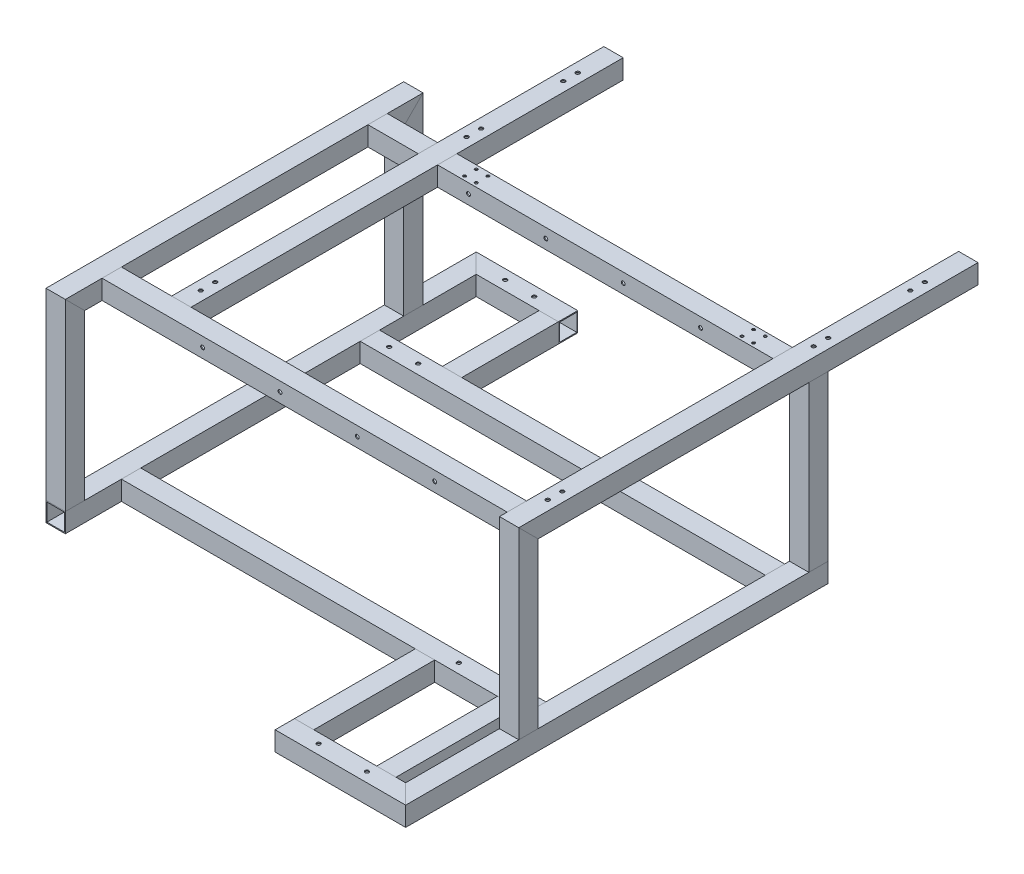
from build123d import *

# Parameters (mm, degrees)
F_SOLIDWORKS2016_SOLIDWORKS_LANG_CHINESE_DEPTH      = 454.142135624
F_SOLIDWORKS2016_SOLIDWORKS_LANG_CHINESE_DEPTH_BACK = 15.142135624
SKETCH_12_W                                         = 20
SKETCH_12_H                                         = 20
SKETCH_12_W_2                                       = 18
SKETCH_12_H_2                                       = 18
SKETCH_12_ON_SEGMENT_2_W                            = 20
SKETCH_12_ON_SEGMENT_2_H                            = 20
SKETCH_12_ON_SEGMENT_2_W_2                          = 18
SKETCH_12_ON_SEGMENT_2_H_2                          = 18
F_SOLIDWORKS2016_SOLIDWORKS_LANG_CHI_4_DEPTH        = 542.284271247
SKETCH_12_ON_SEGMENT_3_W                            = 20
SKETCH_12_ON_SEGMENT_3_H                            = 20
SKETCH_12_ON_SEGMENT_3_W_2                          = 18
SKETCH_12_ON_SEGMENT_3_H_2                          = 18
F_SOLIDWORKS2016_SOLIDWORKS_LANG_CHI_6_DEPTH        = 469.284271247
SKETCH_12_ON_SEGMENT_4_W                            = 20
SKETCH_12_ON_SEGMENT_4_H                            = 20
SKETCH_12_ON_SEGMENT_4_W_2                          = 18
SKETCH_12_ON_SEGMENT_4_H_2                          = 18
F_SOLIDWORKS2016_SOLIDWORKS_LANG_CHI_8_DEPTH        = 542.284271247
SKETCH_12_ON_SEGMENT_5_W                            = 20
SKETCH_12_ON_SEGMENT_5_H                            = 20
SKETCH_12_ON_SEGMENT_5_W_2                          = 18
SKETCH_12_ON_SEGMENT_5_H_2                          = 18
F_SOLIDWORKS2016_SOLIDWORKS_LANG_CHI_10_DEPTH       = 441
SKETCH_12_ON_SEGMENT_6_W                            = 20
SKETCH_12_ON_SEGMENT_6_H                            = 20
SKETCH_12_ON_SEGMENT_6_W_2                          = 18
SKETCH_12_ON_SEGMENT_6_H_2                          = 18
F_SOLIDWORKS2016_SOLIDWORKS_LANG_CHI_13_DEPTH       = 441
SKETCH_12_ON_SEGMENT_7_W                            = 20
SKETCH_12_ON_SEGMENT_7_H                            = 20
SKETCH_12_ON_SEGMENT_7_W_2                          = 18
SKETCH_12_ON_SEGMENT_7_H_2                          = 18
F_SOLIDWORKS2016_SOLIDWORKS_LANG_CHI_16_DEPTH       = 206.142135624
SKETCH_12_ON_SEGMENT_8_W                            = 20
SKETCH_12_ON_SEGMENT_8_H                            = 20
SKETCH_12_ON_SEGMENT_8_W_2                          = 18
SKETCH_12_ON_SEGMENT_8_H_2                          = 18
F_SOLIDWORKS2016_SOLIDWORKS_LANG_CHI_19_DEPTH       = 380.284271247
SKETCH_12_ON_SEGMENT_9_W                            = 20
SKETCH_12_ON_SEGMENT_9_H                            = 20
SKETCH_12_ON_SEGMENT_9_W_2                          = 18
SKETCH_12_ON_SEGMENT_9_H_2                          = 18
F_SOLIDWORKS2016_SOLIDWORKS_LANG_CHI_22_DEPTH       = 206.142135624
SKETCH_12_ON_SEGMENT_10_W                           = 20
SKETCH_12_ON_SEGMENT_10_H                           = 20
SKETCH_12_ON_SEGMENT_10_W_2                         = 18
SKETCH_12_ON_SEGMENT_10_H_2                         = 18
F_SOLIDWORKS2016_SOLIDWORKS_LANG_CHI_25_DEPTH       = 206.142135624
SKETCH_12_ON_SEGMENT_11_W                           = 20
SKETCH_12_ON_SEGMENT_11_H                           = 20
SKETCH_12_ON_SEGMENT_11_W_2                         = 18
SKETCH_12_ON_SEGMENT_11_H_2                         = 18
F_SOLIDWORKS2016_SOLIDWORKS_LANG_CHI_28_DEPTH       = 480.142135624
SKETCH_12_ON_SEGMENT_12_W                           = 20
SKETCH_12_ON_SEGMENT_12_H                           = 20
SKETCH_12_ON_SEGMENT_12_W_2                         = 18
SKETCH_12_ON_SEGMENT_12_H_2                         = 18
F_SOLIDWORKS2016_SOLIDWORKS_LANG_CHI_30_DEPTH       = 192
SKETCH_12_ON_SEGMENT_13_W                           = 20
SKETCH_12_ON_SEGMENT_13_H                           = 20
SKETCH_12_ON_SEGMENT_13_W_2                         = 18
SKETCH_12_ON_SEGMENT_13_H_2                         = 18
F_SOLIDWORKS2016_SOLIDWORKS_LANG_CHI_33_DEPTH       = 441
SKETCH_12_ON_SEGMENT_14_W                           = 20
SKETCH_12_ON_SEGMENT_14_H                           = 20
SKETCH_12_ON_SEGMENT_14_W_2                         = 18
SKETCH_12_ON_SEGMENT_14_H_2                         = 18
F_SOLIDWORKS2016_SOLIDWORKS_LANG_CHI_36_DEPTH       = 458
SKETCH_12_ON_SEGMENT_15_W                           = 20
SKETCH_12_ON_SEGMENT_15_H                           = 20
SKETCH_12_ON_SEGMENT_15_W_2                         = 18
SKETCH_12_ON_SEGMENT_15_H_2                         = 18
F_SOLIDWORKS2016_SOLIDWORKS_LANG_CHI_38_DEPTH       = 369
SKETCH_12_ON_SEGMENT_16_W                           = 20
SKETCH_12_ON_SEGMENT_16_H                           = 20
SKETCH_12_ON_SEGMENT_16_W_2                         = 18
SKETCH_12_ON_SEGMENT_16_H_2                         = 18
F_SOLIDWORKS2016_SOLIDWORKS_LANG_CHI_41_DEPTH       = 74
SKETCH_12_ON_SEGMENT_17_W                           = 20
SKETCH_12_ON_SEGMENT_17_H                           = 20
SKETCH_12_ON_SEGMENT_17_W_2                         = 18
SKETCH_12_ON_SEGMENT_17_H_2                         = 18
F_SOLIDWORKS2016_SOLIDWORKS_LANG_CHI_44_DEPTH       = 147
SKETCH_12_ON_SEGMENT_18_W                           = 20
SKETCH_12_ON_SEGMENT_18_H                           = 20
SKETCH_12_ON_SEGMENT_18_W_2                         = 18
SKETCH_12_ON_SEGMENT_18_H_2                         = 18
F_SOLIDWORKS2016_SOLIDWORKS_LANG_CHI_47_DEPTH       = 147
SKETCH_13_R                                         = 2
CUT_EXTRUDE_1_DEPTH                                 = 674.740306053
SKETCH_14_R                                         = 2
CUT_EXTRUDE_2_DEPTH                                 = 674.740306053
CUT_EXTRUDE_4_REACH                                 = 681.651
SKETCH_16_R                                         = 2
SKETCH_23_W                                         = 354
SKETCH_23_H                                         = 95
CUT_EXTRUDE_10_DEPTH                                = 674.740306053
SKETCH_24_W                                         = 20
SKETCH_24_H                                         = 100
EXTRUDE_2_DEPTH                                     = 20
SKETCH_25_R                                         = 2
CUT_EXTRUDE_11_DEPTH                                = 20
SKETCH_27_R                                         = 2
CUT_EXTRUDE_12_DEPTH                                = 679.004424764
CUT_EXTRUDE_13_DEPTH                                = 20
SKETCH_29_R                                         = 1.5
CUT_EXTRUDE_14_DEPTH                                = 20


with BuildPart() as part:
    # 草图12 → F_SOLIDWORKS2016_SOLIDWORKS_LANG_CHINESE (new, two sides: drawn at the far end of the back side and taken through both)
    with BuildSketch(Plane(origin=(0, 0, 117), x_dir=(0, 0, 1), z_dir=(-1, 0, 0)).offset(-F_SOLIDWORKS2016_SOLIDWORKS_LANG_CHINESE_DEPTH_BACK)):
        Rectangle(SKETCH_12_W, SKETCH_12_H)
        Rectangle(SKETCH_12_W_2, SKETCH_12_H_2, mode=Mode.SUBTRACT)
    extrude(amount=F_SOLIDWORKS2016_SOLIDWORKS_LANG_CHINESE_DEPTH + F_SOLIDWORKS2016_SOLIDWORKS_LANG_CHINESE_DEPTH_BACK)

    # F_SOLIDWORKS2016_SOLIDWORKS_LANG_CHI 2
    split(bisect_by=Plane(origin=(0, 0, 117), x_dir=(0, -1, 0), z_dir=(-0.707106781, 0, 0.707106781)), keep=Keep.TOP)

    # F_SOLIDWORKS2016_SOLIDWORKS_LANG_CHI 3
    split(bisect_by=Plane(origin=(-439, 0, 117), x_dir=(0, 1, 0), z_dir=(0.707106781, 0, 0.707106781)), keep=Keep.TOP)


with BuildPart() as body_2:
    # 草图12 on segment 2 (carried to segment 2) → F_SOLIDWORKS2016_SOLIDWORKS_LANG_CHI 4 (new body)
    with BuildSketch(Plane(origin=(-439, 0, 132.142135624), x_dir=(-1, 0, 0), z_dir=(0, 0, -1))):
        Rectangle(SKETCH_12_ON_SEGMENT_2_W, SKETCH_12_ON_SEGMENT_2_H)
        Rectangle(SKETCH_12_ON_SEGMENT_2_W_2, SKETCH_12_ON_SEGMENT_2_H_2, mode=Mode.SUBTRACT)
    extrude(amount=F_SOLIDWORKS2016_SOLIDWORKS_LANG_CHI_4_DEPTH)

    # F_SOLIDWORKS2016_SOLIDWORKS_LANG_CHI 4 m
    split(bisect_by=Plane(origin=(-439, 0, 117), x_dir=(0, -1, 0), z_dir=(-0.707106781, 0, -0.707106781)), keep=Keep.TOP)

    # F_SOLIDWORKS2016_SOLIDWORKS_LANG_CHI 5
    split(bisect_by=Plane(origin=(-439, 0, -395), x_dir=(0, -1, 0), z_dir=(-0.707106781, 0, 0.707106781)), keep=Keep.TOP)


with BuildPart() as body_3:
    # 草图12 on segment 3 (carried to segment 3) → F_SOLIDWORKS2016_SOLIDWORKS_LANG_CHI 6 (new body)
    with BuildSketch(Plane(origin=(-454.142135624, 0, -395), x_dir=(0, 0, -1), z_dir=(1, 0, 0))):
        Rectangle(SKETCH_12_ON_SEGMENT_3_W, SKETCH_12_ON_SEGMENT_3_H)
        Rectangle(SKETCH_12_ON_SEGMENT_3_W_2, SKETCH_12_ON_SEGMENT_3_H_2, mode=Mode.SUBTRACT)
    extrude(amount=F_SOLIDWORKS2016_SOLIDWORKS_LANG_CHI_6_DEPTH)

    # F_SOLIDWORKS2016_SOLIDWORKS_LANG_CHI 6 m
    split(bisect_by=Plane(origin=(-439, 0, -395), x_dir=(0, 1, 0), z_dir=(0.707106781, 0, -0.707106781)), keep=Keep.TOP)

    # F_SOLIDWORKS2016_SOLIDWORKS_LANG_CHI 7
    split(bisect_by=Plane(origin=(0, 0, -395), x_dir=(0, -1, 0), z_dir=(-0.707106781, 0, -0.707106781)), keep=Keep.TOP)


with BuildPart() as body_4:
    # 草图12 on segment 4 (carried to segment 4) → F_SOLIDWORKS2016_SOLIDWORKS_LANG_CHI 8 (new body)
    with BuildSketch(Plane.XY.offset(-410.142135624)):
        Rectangle(SKETCH_12_ON_SEGMENT_4_W, SKETCH_12_ON_SEGMENT_4_H)
        Rectangle(SKETCH_12_ON_SEGMENT_4_W_2, SKETCH_12_ON_SEGMENT_4_H_2, mode=Mode.SUBTRACT)
    extrude(amount=F_SOLIDWORKS2016_SOLIDWORKS_LANG_CHI_8_DEPTH)

    # F_SOLIDWORKS2016_SOLIDWORKS_LANG_CHI 8 m
    split(bisect_by=Plane(origin=(0, 0, -395), x_dir=(0, 1, 0), z_dir=(0.707106781, 0, 0.707106781)), keep=Keep.TOP)

    # F_SOLIDWORKS2016_SOLIDWORKS_LANG_CHI 9
    split(bisect_by=Plane(origin=(0, 0, 117), x_dir=(0, 1, 0), z_dir=(0.707106781, 0, -0.707106781)), keep=Keep.TOP)


with BuildPart() as body_5:
    # 草图12 on segment 5 (carried to segment 5) → F_SOLIDWORKS2016_SOLIDWORKS_LANG_CHI 10 (new body)
    with BuildSketch(Plane(origin=(-440, 0, -28), x_dir=(0, 0, -1), z_dir=(1, 0, 0))):
        Rectangle(SKETCH_12_ON_SEGMENT_5_W, SKETCH_12_ON_SEGMENT_5_H)
        Rectangle(SKETCH_12_ON_SEGMENT_5_W_2, SKETCH_12_ON_SEGMENT_5_H_2, mode=Mode.SUBTRACT)
    extrude(amount=F_SOLIDWORKS2016_SOLIDWORKS_LANG_CHI_10_DEPTH)

    # F_SOLIDWORKS2016_SOLIDWORKS_LANG_CHI 11
    split(bisect_by=Plane(origin=(-429, 0, -28), x_dir=(0, 1, 0), z_dir=(1, 0, 0)), keep=Keep.TOP)

    # F_SOLIDWORKS2016_SOLIDWORKS_LANG_CHI 12
    split(bisect_by=Plane(origin=(-10, 0, -28), x_dir=(0, -1, 0), z_dir=(-1, 0, 0)), keep=Keep.TOP)


with BuildPart() as body_6:
    # 草图12 on segment 6 (carried to segment 6) → F_SOLIDWORKS2016_SOLIDWORKS_LANG_CHI 13 (new body)
    with BuildSketch(Plane(origin=(-440, 0, -275), x_dir=(0, 0, -1), z_dir=(1, 0, 0))):
        Rectangle(SKETCH_12_ON_SEGMENT_6_W, SKETCH_12_ON_SEGMENT_6_H)
        Rectangle(SKETCH_12_ON_SEGMENT_6_W_2, SKETCH_12_ON_SEGMENT_6_H_2, mode=Mode.SUBTRACT)
    extrude(amount=F_SOLIDWORKS2016_SOLIDWORKS_LANG_CHI_13_DEPTH)

    # F_SOLIDWORKS2016_SOLIDWORKS_LANG_CHI 14
    split(bisect_by=Plane(origin=(-429, 0, -275), x_dir=(0, 1, 0), z_dir=(1, 0, 0)), keep=Keep.TOP)

    # F_SOLIDWORKS2016_SOLIDWORKS_LANG_CHI 15
    split(bisect_by=Plane(origin=(-10, 0, -275), x_dir=(0, -1, 0), z_dir=(-1, 0, 0)), keep=Keep.TOP)


with BuildPart() as body_7:
    # 草图12 on segment 7 (carried to segment 7) → F_SOLIDWORKS2016_SOLIDWORKS_LANG_CHI 16 (new body)
    with BuildSketch(Plane(origin=(-439, 205.142135624, -320), x_dir=(0, 0, 1), z_dir=(0, -1, 0))):
        Rectangle(SKETCH_12_ON_SEGMENT_7_W, SKETCH_12_ON_SEGMENT_7_H)
        Rectangle(SKETCH_12_ON_SEGMENT_7_W_2, SKETCH_12_ON_SEGMENT_7_H_2, mode=Mode.SUBTRACT)
    extrude(amount=F_SOLIDWORKS2016_SOLIDWORKS_LANG_CHI_16_DEPTH)

    # F_SOLIDWORKS2016_SOLIDWORKS_LANG_CHI 17
    split(bisect_by=Plane(origin=(-439, 190, -320), x_dir=(1, 0, 0), z_dir=(0, -0.707106781, -0.707106781)), keep=Keep.TOP)

    # F_SOLIDWORKS2016_SOLIDWORKS_LANG_CHI 18
    split(bisect_by=Plane(origin=(-439, 10, -320), x_dir=(-1, 0, 0), z_dir=(0, 1, 0)), keep=Keep.TOP)


with BuildPart() as body_8:
    # 草图12 on segment 8 (carried to segment 8) → F_SOLIDWORKS2016_SOLIDWORKS_LANG_CHI 19 (new body)
    with BuildSketch(Plane(origin=(-439, 190, 45.142135624), x_dir=(-1, 0, 0), z_dir=(0, 0, -1))):
        Rectangle(SKETCH_12_ON_SEGMENT_8_W, SKETCH_12_ON_SEGMENT_8_H)
        Rectangle(SKETCH_12_ON_SEGMENT_8_W_2, SKETCH_12_ON_SEGMENT_8_H_2, mode=Mode.SUBTRACT)
    extrude(amount=F_SOLIDWORKS2016_SOLIDWORKS_LANG_CHI_19_DEPTH)

    # F_SOLIDWORKS2016_SOLIDWORKS_LANG_CHI 20
    split(bisect_by=Plane(origin=(-439, 190, 30), x_dir=(-1, 0, 0), z_dir=(0, 0.707106781, -0.707106781)), keep=Keep.TOP)

    # F_SOLIDWORKS2016_SOLIDWORKS_LANG_CHI 21
    split(bisect_by=Plane(origin=(-439, 190, -320), x_dir=(-1, 0, 0), z_dir=(0, 0.707106781, 0.707106781)), keep=Keep.TOP)


with BuildPart() as body_9:
    # 草图12 on segment 9 (carried to segment 9) → F_SOLIDWORKS2016_SOLIDWORKS_LANG_CHI 22 (new body)
    with BuildSketch(Plane(origin=(-439, 205.142135624, 30), x_dir=(0, 0, 1), z_dir=(0, -1, 0))):
        Rectangle(SKETCH_12_ON_SEGMENT_9_W, SKETCH_12_ON_SEGMENT_9_H)
        Rectangle(SKETCH_12_ON_SEGMENT_9_W_2, SKETCH_12_ON_SEGMENT_9_H_2, mode=Mode.SUBTRACT)
    extrude(amount=F_SOLIDWORKS2016_SOLIDWORKS_LANG_CHI_22_DEPTH)

    # F_SOLIDWORKS2016_SOLIDWORKS_LANG_CHI 23
    split(bisect_by=Plane(origin=(-439, 190, 30), x_dir=(1, 0, 0), z_dir=(0, -0.707106781, 0.707106781)), keep=Keep.TOP)

    # F_SOLIDWORKS2016_SOLIDWORKS_LANG_CHI 24
    split(bisect_by=Plane(origin=(-439, 10, 30), x_dir=(-1, 0, 0), z_dir=(0, 1, 0)), keep=Keep.TOP)


with BuildPart() as body_10:
    # 草图12 on segment 10 (carried to segment 10) → F_SOLIDWORKS2016_SOLIDWORKS_LANG_CHI 25 (new body)
    with BuildSketch(Plane.ZX.offset(-1)):
        Rectangle(SKETCH_12_ON_SEGMENT_10_W, SKETCH_12_ON_SEGMENT_10_H)
        Rectangle(SKETCH_12_ON_SEGMENT_10_W_2, SKETCH_12_ON_SEGMENT_10_H_2, mode=Mode.SUBTRACT)
    extrude(amount=F_SOLIDWORKS2016_SOLIDWORKS_LANG_CHI_25_DEPTH)

    # F_SOLIDWORKS2016_SOLIDWORKS_LANG_CHI 26
    split(bisect_by=Plane(origin=(0, 190, 0), x_dir=(1, 0, 0), z_dir=(0, -0.707106781, 0.707106781)), keep=Keep.TOP)

    # F_SOLIDWORKS2016_SOLIDWORKS_LANG_CHI 27
    split(bisect_by=Plane(origin=(0, 10, 0), x_dir=(-1, 0, 0), z_dir=(0, 1, 0)), keep=Keep.TOP)


with BuildPart() as body_11:
    # 草图12 on segment 11 (carried to segment 11) → F_SOLIDWORKS2016_SOLIDWORKS_LANG_CHI 28 (new body)
    with BuildSketch(Plane(origin=(0, 190, 15.142135624), x_dir=(-1, 0, 0), z_dir=(0, 0, -1))):
        Rectangle(SKETCH_12_ON_SEGMENT_11_W, SKETCH_12_ON_SEGMENT_11_H)
        Rectangle(SKETCH_12_ON_SEGMENT_11_W_2, SKETCH_12_ON_SEGMENT_11_H_2, mode=Mode.SUBTRACT)
    extrude(amount=F_SOLIDWORKS2016_SOLIDWORKS_LANG_CHI_28_DEPTH)

    # F_SOLIDWORKS2016_SOLIDWORKS_LANG_CHI 29
    split(bisect_by=Plane(origin=(0, 190, 0), x_dir=(-1, 0, 0), z_dir=(0, 0.707106781, -0.707106781)), keep=Keep.TOP)

    # 切除-拉伸4: up to this face of the body (flat: up to its plane)
    cut_extrude_4_end = Plane(body_11.part.faces().sort_by_distance((0, 180, -237.5))[0])
    # 草图16 → 切除-拉伸4 (cut, up to the picked face)
    with BuildSketch(Plane(origin=(0, 200, 0), x_dir=(1, 0, 0), z_dir=(0, 1, 0)), mode=Mode.PRIVATE) as cut_extrude_4_sk1:
        with Locations(Location((0, 420, 0), (0, 0, 180))):
            Circle(SKETCH_16_R)
    cut_extrude_4_tool1 = split(extrude(cut_extrude_4_sk1.sketch, amount=-CUT_EXTRUDE_4_REACH, mode=Mode.PRIVATE), bisect_by=cut_extrude_4_end, keep=Keep.BOTH, mode=Mode.PRIVATE)
    # 草图16 → 切除-拉伸4 (cut, up to the picked face)
    with BuildSketch(Plane(origin=(0, 200, 0), x_dir=(1, 0, 0), z_dir=(0, 1, 0)), mode=Mode.PRIVATE) as cut_extrude_4_sk2:
        with Locations(Location((0, 405, 0), (0, 0, 180))):
            Circle(SKETCH_16_R)
    cut_extrude_4_tool2 = split(extrude(cut_extrude_4_sk2.sketch, amount=-CUT_EXTRUDE_4_REACH, mode=Mode.PRIVATE), bisect_by=cut_extrude_4_end, keep=Keep.BOTH, mode=Mode.PRIVATE)
    # 草图16 → 切除-拉伸4 (cut, up to the picked face)
    with BuildSketch(Plane(origin=(0, 200, 0), x_dir=(1, 0, 0), z_dir=(0, 1, 0)), mode=Mode.PRIVATE) as cut_extrude_4_sk3:
        with Locations(Location((0, 320, 0), (0, 0, 180))):
            Circle(SKETCH_16_R)
    cut_extrude_4_tool3 = split(extrude(cut_extrude_4_sk3.sketch, amount=-CUT_EXTRUDE_4_REACH, mode=Mode.PRIVATE), bisect_by=cut_extrude_4_end, keep=Keep.BOTH, mode=Mode.PRIVATE)
    # 草图16 → 切除-拉伸4 (cut, up to the picked face)
    with BuildSketch(Plane(origin=(0, 200, 0), x_dir=(1, 0, 0), z_dir=(0, 1, 0)), mode=Mode.PRIVATE) as cut_extrude_4_sk4:
        with Locations(Location((0, 305, 0), (0, 0, 180))):
            Circle(SKETCH_16_R)
    cut_extrude_4_tool4 = split(extrude(cut_extrude_4_sk4.sketch, amount=-CUT_EXTRUDE_4_REACH, mode=Mode.PRIVATE), bisect_by=cut_extrude_4_end, keep=Keep.BOTH, mode=Mode.PRIVATE)
    # 草图16 → 切除-拉伸4 (cut, up to the picked face)
    with BuildSketch(Plane(origin=(0, 200, 0), x_dir=(1, 0, 0), z_dir=(0, 1, 0)), mode=Mode.PRIVATE) as cut_extrude_4_sk5:
        with Locations(Location((0, 45, 0), (0, 0, 180))):
            Circle(SKETCH_16_R)
    cut_extrude_4_tool5 = split(extrude(cut_extrude_4_sk5.sketch, amount=-CUT_EXTRUDE_4_REACH, mode=Mode.PRIVATE), bisect_by=cut_extrude_4_end, keep=Keep.BOTH, mode=Mode.PRIVATE)
    # 草图16 → 切除-拉伸4 (cut, up to the picked face)
    with BuildSketch(Plane(origin=(0, 200, 0), x_dir=(1, 0, 0), z_dir=(0, 1, 0)), mode=Mode.PRIVATE) as cut_extrude_4_sk6:
        with Locations(Location((0, 30, 0), (0, 0, 180))):
            Circle(SKETCH_16_R)
    cut_extrude_4_tool6 = split(extrude(cut_extrude_4_sk6.sketch, amount=-CUT_EXTRUDE_4_REACH, mode=Mode.PRIVATE), bisect_by=cut_extrude_4_end, keep=Keep.BOTH, mode=Mode.PRIVATE)
    add(cut_extrude_4_tool1.solids().sort_by(Axis((0, 200, -420), (0, -1, 0)))[0], mode=Mode.SUBTRACT)
    add(cut_extrude_4_tool2.solids().sort_by(Axis((0, 200, -405), (0, -1, 0)))[0], mode=Mode.SUBTRACT)
    add(cut_extrude_4_tool3.solids().sort_by(Axis((0, 200, -320), (0, -1, 0)))[0], mode=Mode.SUBTRACT)
    add(cut_extrude_4_tool4.solids().sort_by(Axis((0, 200, -305), (0, -1, 0)))[0], mode=Mode.SUBTRACT)
    add(cut_extrude_4_tool5.solids().sort_by(Axis((0, 200, -45), (0, -1, 0)))[0], mode=Mode.SUBTRACT)
    add(cut_extrude_4_tool6.solids().sort_by(Axis((0, 200, -30), (0, -1, 0)))[0], mode=Mode.SUBTRACT)


with BuildPart() as body_12:
    # 草图12 on segment 12 (carried to segment 12) → F_SOLIDWORKS2016_SOLIDWORKS_LANG_CHI 30 (new body)
    with BuildSketch(Plane(origin=(0, 191, -300), x_dir=(0, 0, 1), z_dir=(0, -1, 0))):
        Rectangle(SKETCH_12_ON_SEGMENT_12_W, SKETCH_12_ON_SEGMENT_12_H)
        Rectangle(SKETCH_12_ON_SEGMENT_12_W_2, SKETCH_12_ON_SEGMENT_12_H_2, mode=Mode.SUBTRACT)
    extrude(amount=F_SOLIDWORKS2016_SOLIDWORKS_LANG_CHI_30_DEPTH)

    # F_SOLIDWORKS2016_SOLIDWORKS_LANG_CHI 31
    split(bisect_by=Plane(origin=(0, 180, -300), x_dir=(1, 0, 0), z_dir=(0, -1, 0)), keep=Keep.TOP)

    # F_SOLIDWORKS2016_SOLIDWORKS_LANG_CHI 32
    split(bisect_by=Plane(origin=(0, 10, -300), x_dir=(-1, 0, 0), z_dir=(0, 1, 0)), keep=Keep.TOP)


with BuildPart() as body_13:
    # 草图12 on segment 13 (carried to segment 13) → F_SOLIDWORKS2016_SOLIDWORKS_LANG_CHI 33 (new body)
    with BuildSketch(Plane(origin=(-440, 190, -8), x_dir=(0, 0, -1), z_dir=(1, 0, 0))):
        Rectangle(SKETCH_12_ON_SEGMENT_13_W, SKETCH_12_ON_SEGMENT_13_H)
        Rectangle(SKETCH_12_ON_SEGMENT_13_W_2, SKETCH_12_ON_SEGMENT_13_H_2, mode=Mode.SUBTRACT)
    extrude(amount=F_SOLIDWORKS2016_SOLIDWORKS_LANG_CHI_33_DEPTH)

    # F_SOLIDWORKS2016_SOLIDWORKS_LANG_CHI 34
    split(bisect_by=Plane(origin=(-429, 190, -8), x_dir=(0, 1, 0), z_dir=(1, 0, 0)), keep=Keep.TOP)

    # F_SOLIDWORKS2016_SOLIDWORKS_LANG_CHI 35
    split(bisect_by=Plane(origin=(-10, 190, -8), x_dir=(0, -1, 0), z_dir=(-1, 0, 0)), keep=Keep.TOP)


with BuildPart() as body_14:
    # 草图12 on segment 14 (carried to segment 14) → F_SOLIDWORKS2016_SOLIDWORKS_LANG_CHI 36 (new body)
    with BuildSketch(Plane(origin=(-367, 190, -7), x_dir=(-1, 0, 0), z_dir=(0, 0, -1))):
        Rectangle(SKETCH_12_ON_SEGMENT_14_W, SKETCH_12_ON_SEGMENT_14_H)
        Rectangle(SKETCH_12_ON_SEGMENT_14_W_2, SKETCH_12_ON_SEGMENT_14_H_2, mode=Mode.SUBTRACT)
    extrude(amount=F_SOLIDWORKS2016_SOLIDWORKS_LANG_CHI_36_DEPTH)

    # F_SOLIDWORKS2016_SOLIDWORKS_LANG_CHI 37
    split(bisect_by=Plane(origin=(-367, 190, -18), x_dir=(0, 1, 0), z_dir=(0, 0, -1)), keep=Keep.TOP)

    # 草图25 → 切除-拉伸11 (cut)
    with BuildSketch(Plane(origin=(0, 200, 0), x_dir=(1, 0, 0), z_dir=(0, 1, 0))):
        with Locations(Location((-367, 38, 0), (0, 0, 180))):
            Circle(SKETCH_25_R)
        with Locations(Location((-367, 53, 0), (0, 0, 180))):
            Circle(SKETCH_25_R)
        with Locations(Location((-367, 328, 0), (0, 0, 180))):
            Circle(SKETCH_25_R)
        with Locations(Location((-367, 313, 0), (0, 0, 180))):
            Circle(SKETCH_25_R)
        with Locations(Location((-367, 428, 0), (0, 0, 180))):
            Circle(SKETCH_25_R)
        with Locations(Location((-367, 413, 0), (0, 0, 180))):
            Circle(SKETCH_25_R)
    extrude(amount=-CUT_EXTRUDE_11_DEPTH, mode=Mode.SUBTRACT)


with BuildPart() as body_15:
    # 草图12 on segment 15 (carried to segment 15) → F_SOLIDWORKS2016_SOLIDWORKS_LANG_CHI 38 (new body)
    with BuildSketch(Plane(origin=(-368, 190, -283), x_dir=(0, 0, -1), z_dir=(1, 0, 0))):
        Rectangle(SKETCH_12_ON_SEGMENT_15_W, SKETCH_12_ON_SEGMENT_15_H)
        Rectangle(SKETCH_12_ON_SEGMENT_15_W_2, SKETCH_12_ON_SEGMENT_15_H_2, mode=Mode.SUBTRACT)
    extrude(amount=F_SOLIDWORKS2016_SOLIDWORKS_LANG_CHI_38_DEPTH)

    # F_SOLIDWORKS2016_SOLIDWORKS_LANG_CHI 39
    split(bisect_by=Plane(origin=(-357, 190, -283), x_dir=(0, 1, 0), z_dir=(1, 0, 0)), keep=Keep.TOP)

    # F_SOLIDWORKS2016_SOLIDWORKS_LANG_CHI 40
    split(bisect_by=Plane(origin=(-10, 190, -283), x_dir=(0, -1, 0), z_dir=(-1, 0, 0)), keep=Keep.TOP)


with BuildPart() as body_16:
    # 草图12 on segment 16 (carried to segment 16) → F_SOLIDWORKS2016_SOLIDWORKS_LANG_CHI 41 (new body)
    with BuildSketch(Plane(origin=(-440, 190, -283), x_dir=(0, 0, -1), z_dir=(1, 0, 0))):
        Rectangle(SKETCH_12_ON_SEGMENT_16_W, SKETCH_12_ON_SEGMENT_16_H)
        Rectangle(SKETCH_12_ON_SEGMENT_16_W_2, SKETCH_12_ON_SEGMENT_16_H_2, mode=Mode.SUBTRACT)
    extrude(amount=F_SOLIDWORKS2016_SOLIDWORKS_LANG_CHI_41_DEPTH)

    # F_SOLIDWORKS2016_SOLIDWORKS_LANG_CHI 42
    split(bisect_by=Plane(origin=(-429, 190, -283), x_dir=(0, 1, 0), z_dir=(1, 0, 0)), keep=Keep.TOP)

    # F_SOLIDWORKS2016_SOLIDWORKS_LANG_CHI 43
    split(bisect_by=Plane(origin=(-377, 190, -283), x_dir=(0, -1, 0), z_dir=(-1, 0, 0)), keep=Keep.TOP)


with BuildPart() as body_17:
    # 草图12 on segment 17 (carried to segment 17) → F_SOLIDWORKS2016_SOLIDWORKS_LANG_CHI 44 (new body)
    with BuildSketch(Plane(origin=(-115, 0, 118), x_dir=(-1, 0, 0), z_dir=(0, 0, -1))):
        Rectangle(SKETCH_12_ON_SEGMENT_17_W, SKETCH_12_ON_SEGMENT_17_H)
        Rectangle(SKETCH_12_ON_SEGMENT_17_W_2, SKETCH_12_ON_SEGMENT_17_H_2, mode=Mode.SUBTRACT)
    extrude(amount=F_SOLIDWORKS2016_SOLIDWORKS_LANG_CHI_44_DEPTH)

    # F_SOLIDWORKS2016_SOLIDWORKS_LANG_CHI 45
    split(bisect_by=Plane(origin=(-115, 0, 107), x_dir=(0, 1, 0), z_dir=(0, 0, -1)), keep=Keep.TOP)

    # F_SOLIDWORKS2016_SOLIDWORKS_LANG_CHI 46
    split(bisect_by=Plane(origin=(-115, 0, -18), x_dir=(0, -1, 0), z_dir=(0, 0, 1)), keep=Keep.TOP)


with BuildPart() as body_18:
    # 草图12 on segment 18 (carried to segment 18) → F_SOLIDWORKS2016_SOLIDWORKS_LANG_CHI 47 (new body)
    with BuildSketch(Plane(origin=(-30, 0, -29), x_dir=(1, 0, 0), z_dir=(0, 0, 1))):
        Rectangle(SKETCH_12_ON_SEGMENT_18_W, SKETCH_12_ON_SEGMENT_18_H)
        Rectangle(SKETCH_12_ON_SEGMENT_18_W_2, SKETCH_12_ON_SEGMENT_18_H_2, mode=Mode.SUBTRACT)
    extrude(amount=F_SOLIDWORKS2016_SOLIDWORKS_LANG_CHI_47_DEPTH)

    # F_SOLIDWORKS2016_SOLIDWORKS_LANG_CHI 48
    split(bisect_by=Plane(origin=(-30, 0, -18), x_dir=(0, -1, 0), z_dir=(0, 0, 1)), keep=Keep.TOP)

    # F_SOLIDWORKS2016_SOLIDWORKS_LANG_CHI 49
    split(bisect_by=Plane(origin=(-30, 0, 107), x_dir=(0, 1, 0), z_dir=(0, 0, -1)), keep=Keep.TOP)


with BuildPart() as cut_extrude_1_tool:
    # 草图13 → 切除-拉伸1 (new, through all)
    with BuildSketch(Plane(origin=(0, 10, 0), x_dir=(1, 0, 0), z_dir=(0, 1, 0))):
        with Locations(Location((-90, 28, 0), (0, 0, 180))):
            Circle(SKETCH_13_R)
        with Locations(Location((-40, 28, 0), (0, 0, 180))):
            Circle(SKETCH_13_R)
        with Locations(Location((-90, -117, 0), (0, 0, 180))):
            Circle(SKETCH_13_R)
        with Locations(Location((-40, -117, 0), (0, 0, 180))):
            Circle(SKETCH_13_R)
    extrude(amount=-CUT_EXTRUDE_1_DEPTH)


with BuildPart() as part_1:
    add(part.part)

    # 切除-拉伸1: cut by cut_extrude_1_tool
    add(cut_extrude_1_tool.part, mode=Mode.SUBTRACT)


with BuildPart() as body_5_1:
    add(body_5.part)

    # 切除-拉伸1: cut by cut_extrude_1_tool
    add(cut_extrude_1_tool.part, mode=Mode.SUBTRACT)


with BuildPart() as cut_extrude_2_tool:
    # 草图14 → 切除-拉伸2 (new, through all)
    with BuildSketch(Plane(origin=(0, 10, 0), x_dir=(1, 0, 0), z_dir=(0, 1, 0))):
        with Locations(Location((-379, 275, 0), (0, 0, 270))):
            Circle(SKETCH_14_R)
        with Locations(Location((-409, 275, 0), (0, 0, 270))):
            Circle(SKETCH_14_R)
        with Locations(Location((-409, 395, 0), (0, 0, 270))):
            Circle(SKETCH_14_R)
        with Locations(Location((-379, 395, 0), (0, 0, 270))):
            Circle(SKETCH_14_R)
    extrude(amount=-CUT_EXTRUDE_2_DEPTH)


with BuildPart() as body_3_1:
    add(body_3.part)

    # 切除-拉伸2: cut by cut_extrude_2_tool
    add(cut_extrude_2_tool.part, mode=Mode.SUBTRACT)


with BuildPart() as body_6_1:
    add(body_6.part)

    # 切除-拉伸2: cut by cut_extrude_2_tool
    add(cut_extrude_2_tool.part, mode=Mode.SUBTRACT)


with BuildPart() as cut_extrude_10_tool:
    # 草图23 → 切除-拉伸10 (new, through all)
    with BuildSketch(Plane(origin=(0, 10, 0), x_dir=(1, 0, 0), z_dir=(0, 1, 0))):
        with Locations((-167, 357.5)):
            Rectangle(SKETCH_23_W, SKETCH_23_H)
    extrude(amount=-CUT_EXTRUDE_10_DEPTH)


with BuildPart() as body_3_2:
    add(body_3_1.part)

    # 切除-拉伸10: cut by cut_extrude_10_tool
    add(cut_extrude_10_tool.part, mode=Mode.SUBTRACT)


with BuildPart() as body_4_1:
    add(body_4.part)

    # 切除-拉伸10: cut by cut_extrude_10_tool
    add(cut_extrude_10_tool.part, mode=Mode.SUBTRACT)


with BuildPart() as body_19:
    # 草图24 → 凸台-拉伸2 (new body)
    with BuildSketch(Plane(origin=(0, 10, 0), x_dir=(1, 0, 0), z_dir=(0, 1, 0))):
        with Locations((-354, 335)):
            Rectangle(SKETCH_24_W, SKETCH_24_H)
    extrude(amount=-EXTRUDE_2_DEPTH)


with BuildPart() as cut_extrude_12_tool:
    # 草图27 → 切除-拉伸12 (new, through all)
    with BuildSketch(Plane.XY.offset(2)):
        with Locations((-325, 190)):
            Circle(SKETCH_27_R)
        with Locations((-245, 190)):
            Circle(SKETCH_27_R)
        with Locations((-165, 190)):
            Circle(SKETCH_27_R)
        with Locations((-85, 190)):
            Circle(SKETCH_27_R)
    extrude(amount=-CUT_EXTRUDE_12_DEPTH)


with BuildPart() as body_13_1:
    add(body_13.part)

    # 切除-拉伸12: cut by cut_extrude_12_tool
    add(cut_extrude_12_tool.part, mode=Mode.SUBTRACT)


with BuildPart() as body_15_1:
    add(body_15.part)

    # 切除-拉伸12: cut by cut_extrude_12_tool
    add(cut_extrude_12_tool.part, mode=Mode.SUBTRACT)

    # 草图29 → 切除-拉伸14 (cut)
    with BuildSketch(Plane(origin=(0, 200, 0), x_dir=(1, 0, 0), z_dir=(0, 1, 0))):
        with Locations(Location((-46, 289, 0), (0, 0, 270))):
            Circle(SKETCH_29_R)
        with Locations(Location((-34, 289, 0), (0, 0, 270))):
            Circle(SKETCH_29_R)
        with Locations(Location((-34, 277, 0), (0, 0, 270))):
            Circle(SKETCH_29_R)
        with Locations(Location((-46, 277, 0), (0, 0, 270))):
            Circle(SKETCH_29_R)
        with Locations(Location((-321, 277, 0), (0, 0, 270))):
            Circle(SKETCH_29_R)
        with Locations(Location((-333, 277, 0), (0, 0, 270))):
            Circle(SKETCH_29_R)
        with Locations(Location((-333, 289, 0), (0, 0, 270))):
            Circle(SKETCH_29_R)
        with Locations(Location((-321, 289, 0), (0, 0, 270))):
            Circle(SKETCH_29_R)
    extrude(amount=-CUT_EXTRUDE_14_DEPTH, mode=Mode.SUBTRACT)


with BuildPart() as cut_extrude_13_tool:
    # 草图28 → 切除-拉伸13 (new body)
    with BuildSketch(Plane(origin=(0, 10, 0), x_dir=(1, 0, 0), z_dir=(0, 1, 0))):
        Polygon((-125, -107), (-125, -127), (-449, -127), (-449, -40), (-429, -40), align=None)
    extrude(amount=-CUT_EXTRUDE_13_DEPTH)


with BuildPart() as part_2:
    add(part_1.part)

    # 切除-拉伸13: cut by cut_extrude_13_tool
    add(cut_extrude_13_tool.part, mode=Mode.SUBTRACT)


with BuildPart() as body_2_1:
    add(body_2.part)

    # 切除-拉伸13: cut by cut_extrude_13_tool
    add(cut_extrude_13_tool.part, mode=Mode.SUBTRACT)


solid = Compound([body_7.part, body_8.part, body_9.part, body_10.part, body_11.part, body_12.part, body_14.part, body_16.part, body_17.part, body_18.part, body_5_1.part, body_6_1.part, body_3_2.part, body_4_1.part, body_19.part, body_13_1.part, body_15_1.part, part_2.part, body_2_1.part])
